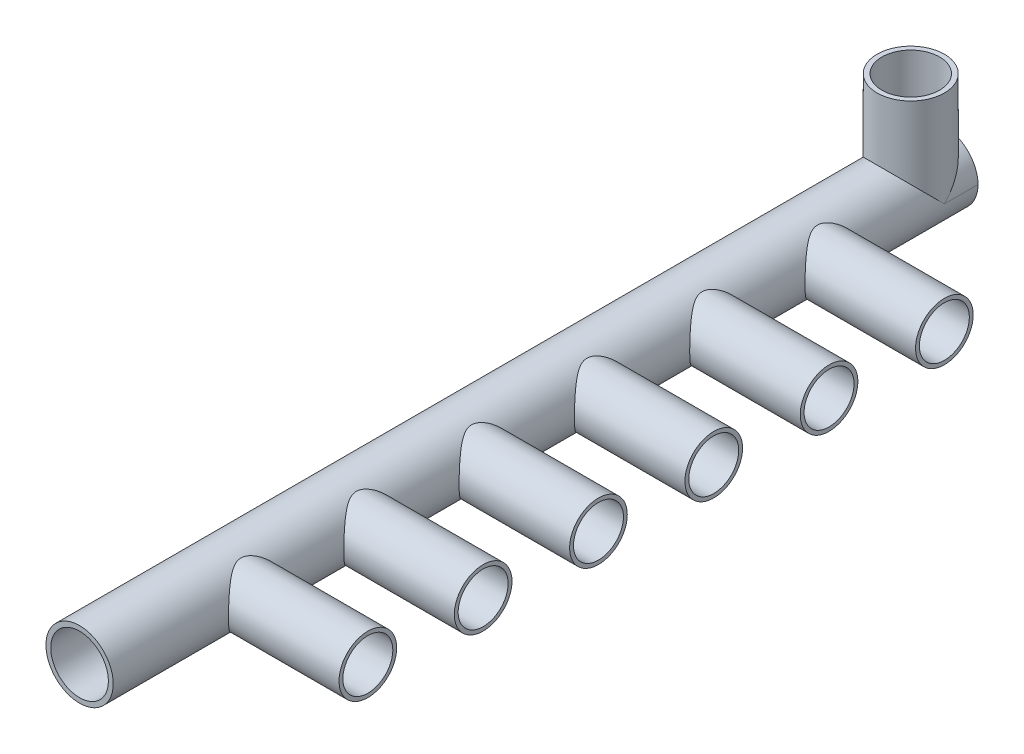
from build123d import *
from build123d.topology import SkipClean

# Parameters (mm, degrees)
SKETCH1_R           = 35
BOSS_EXTRUDE1_DEPTH = 900
SKETCH2_R           = 30
SKETCH2_R_2         = 26
BOSS_EXTRUDE2_DEPTH = 150
SKETCH4_R           = 26
CUT_EXTRUDE2_DEPTH  = 200
SKETCH5_R           = 35
SKETCH5_R_2         = 28
BOSS_EXTRUDE3_DEPTH = 100
SKETCH6_R           = 30
CUT_EXTRUDE3_DEPTH  = 895
SKETCH7_R           = 30
CUT_EXTRUDE4_DEPTH  = 104


with BuildPart() as part:
    # Sketch1 → Boss-Extrude1 (new body)
    with BuildSketch(Plane.XY):
        Circle(SKETCH1_R)
    extrude(amount=BOSS_EXTRUDE1_DEPTH)

    # Sketch2 → Boss-Extrude2 (add)
    # profile 1 of 6: a face of its own
    with BuildSketch(Plane(origin=(0, 0, 0), x_dir=(0, 0, -1), z_dir=(1, 0, 0))):
        with Locations((-750, 0)):
            Circle(SKETCH2_R)
        with Locations(Location((-750, 0, 0), (0, 0, 180))):
            Circle(SKETCH2_R_2, mode=Mode.SUBTRACT)
    # profile 2 of 6: a face of its own
    with BuildSketch(Plane(origin=(0, 0, 0), x_dir=(0, 0, -1), z_dir=(1, 0, 0))):
        with Locations((-630, 0)):
            Circle(SKETCH2_R)
        with Locations(Location((-630, 0, 0), (0, 0, 180))):
            Circle(SKETCH2_R_2, mode=Mode.SUBTRACT)
    # profile 3 of 6: a face of its own
    with BuildSketch(Plane(origin=(0, 0, 0), x_dir=(0, 0, -1), z_dir=(1, 0, 0))):
        with Locations((-510, 0)):
            Circle(SKETCH2_R)
        with Locations(Location((-510, 0, 0), (0, 0, 180))):
            Circle(SKETCH2_R_2, mode=Mode.SUBTRACT)
    # profile 4 of 6: a face of its own
    with BuildSketch(Plane(origin=(0, 0, 0), x_dir=(0, 0, -1), z_dir=(1, 0, 0))):
        with Locations((-390, 0)):
            Circle(SKETCH2_R)
        with Locations(Location((-390, 0, 0), (0, 0, 180))):
            Circle(SKETCH2_R_2, mode=Mode.SUBTRACT)
    # profile 5 of 6: a face of its own
    with BuildSketch(Plane(origin=(0, 0, 0), x_dir=(0, 0, -1), z_dir=(1, 0, 0))):
        with Locations((-270, 0)):
            Circle(SKETCH2_R)
        with Locations(Location((-270, 0, 0), (0, 0, 180))):
            Circle(SKETCH2_R_2, mode=Mode.SUBTRACT)
    # profile 6 of 6: a face of its own
    with BuildSketch(Plane(origin=(0, 0, 0), x_dir=(0, 0, -1), z_dir=(1, 0, 0))):
        with Locations((-150, 0)):
            Circle(SKETCH2_R)
        with Locations(Location((-150, 0, 0), (0, 0, 180))):
            Circle(SKETCH2_R_2, mode=Mode.SUBTRACT)
    extrude(amount=BOSS_EXTRUDE2_DEPTH)

    # Sketch4 → Cut-Extrude2 (cut)
    with BuildSketch(Plane(origin=(0, 0, 0), x_dir=(0, 0, -1), z_dir=(1, 0, 0))):
        with Locations((-750, 0)):
            Circle(SKETCH4_R)
        with Locations((-630, 0)):
            Circle(SKETCH4_R)
        with Locations((-510, 0)):
            Circle(SKETCH4_R)
        with Locations((-390, 0)):
            Circle(SKETCH4_R)
        with Locations((-270, 0)):
            Circle(SKETCH4_R)
        with Locations((-150, 0)):
            Circle(SKETCH4_R)
    extrude(amount=CUT_EXTRUDE2_DEPTH, mode=Mode.SUBTRACT)

    # Sketch5 → Boss-Extrude3 (add)
    with SkipClean():  # the faces are left unmerged after this step: merging them gives an invalid solid
        with BuildSketch(Plane(origin=(0, 0, 0), x_dir=(1, 0, 0), z_dir=(0, 1, 0))):
            with Locations(Location((0, -35, 0), (0, 0, 90))):
                Circle(SKETCH5_R)
            with Locations(Location((0, -35, 0), (0, 0, 90))):
                Circle(SKETCH5_R_2, mode=Mode.SUBTRACT)
        extrude(amount=BOSS_EXTRUDE3_DEPTH)

    # Sketch6 → Cut-Extrude3 (cut)
    with SkipClean():  # the faces are left unmerged after this step: merging them gives an invalid solid
        with BuildSketch(Plane.XY.offset(900)):
            Circle(SKETCH6_R)
        extrude(amount=-CUT_EXTRUDE3_DEPTH, mode=Mode.SUBTRACT)

    # Sketch7 → Cut-Extrude4 (cut)
    with SkipClean():  # the faces are left unmerged after this step: merging them gives an invalid solid
        with BuildSketch(Plane(origin=(0, 100, 0), x_dir=(1, 0, 0), z_dir=(0, 1, 0))):
            with Locations(Location((0, -35, 0), (0, 0, 270))):
                Circle(SKETCH7_R)
        extrude(amount=-CUT_EXTRUDE4_DEPTH, mode=Mode.SUBTRACT)


solid = part.part
